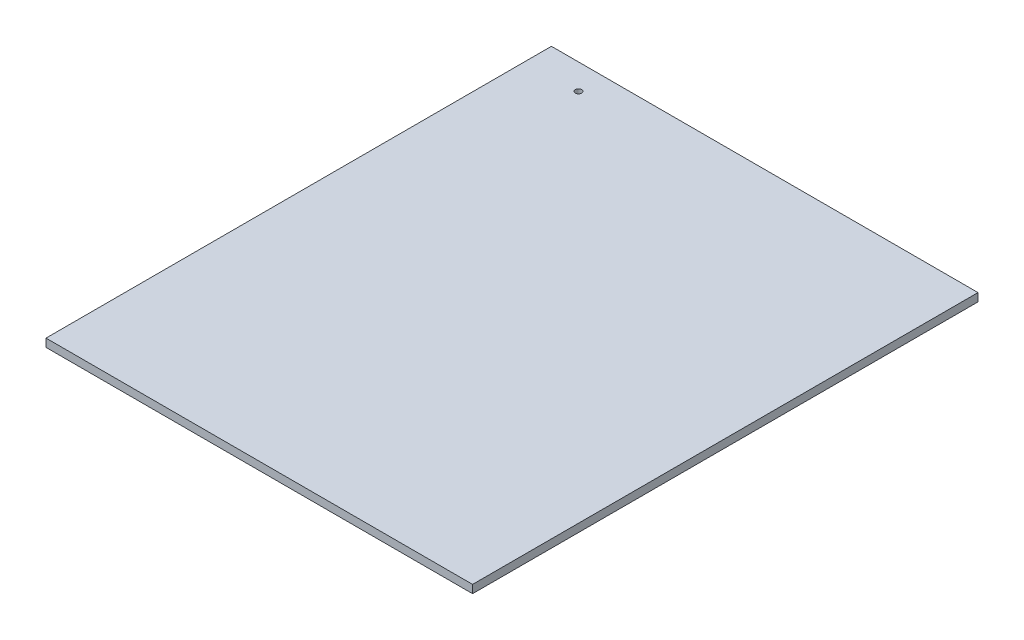
from build123d import *

# Parameters (mm, degrees)
SKETCH1_W           = 211
SKETCH1_H           = 250
SKETCH1_R           = 1.55
BOSS_EXTRUDE1_DEPTH = 4


with BuildPart() as part:
    # Sketch1 → Boss-Extrude1 (new body)
    with BuildSketch(Plane(origin=(0, 0, 0), x_dir=(1, 0, 0), z_dir=(0, 1, 0))):
        with Locations((-24.673203143, -104.358465833)):
            Rectangle(SKETCH1_W, SKETCH1_H)
        with Locations(Location((-104.173203143, 8.031251608, 0), (0, 0, 270))):
            Circle(SKETCH1_R, mode=Mode.SUBTRACT)
    extrude(amount=BOSS_EXTRUDE1_DEPTH)


solid = part.part
